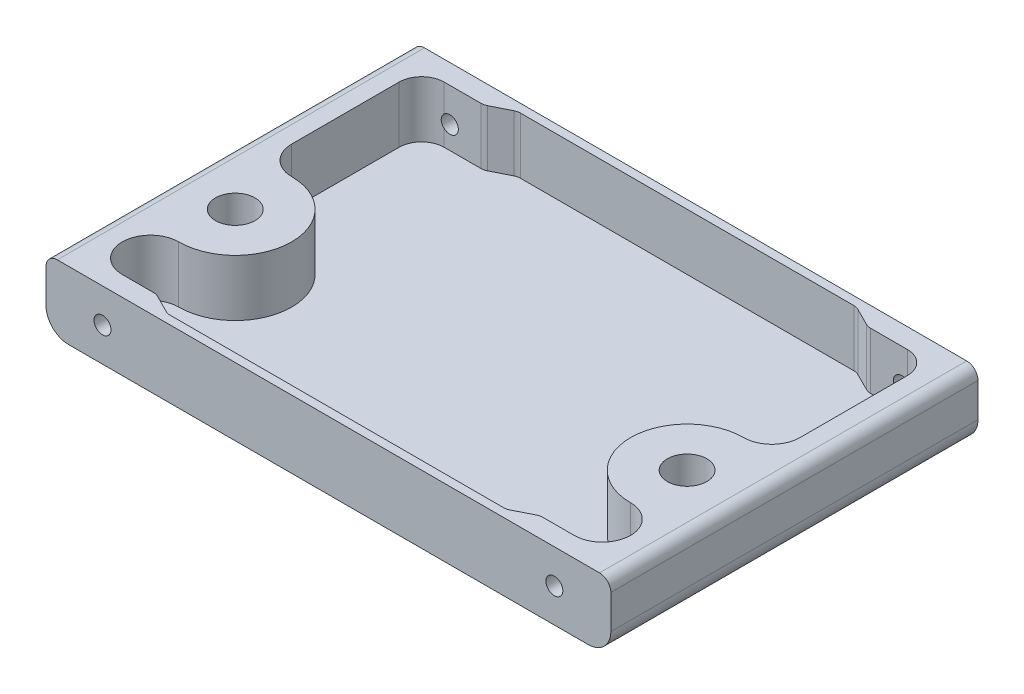
from build123d import *

# Parameters (mm, degrees)
SKETCH_1_W          = 100
SKETCH_1_H          = 65
EXTRUDE_1_DEPTH     = 12
SKETCH_2_R          = 3.5
CUT_EXTRUDE_2_DEPTH = 10
SKETCH_3_R          = 3.5
CUT_EXTRUDE_3_DEPTH = 61.466933112
SKETCH_4_R          = 3.5
CUT_EXTRUDE_4_DEPTH = 61.466933112
CUT_EXTRUDE_5_REACH = 84.879
SKETCH_5_R          = 1.5
CUT_EXTRUDE_6_REACH = 84.879
SKETCH_6_R          = 1.5
FILLET_3_R          = 2
FILLET_4_R          = 4


with BuildPart() as part:
    # 草图1 → 凸台-拉伸1 (new body)
    with BuildSketch(Plane(origin=(0, 0, 0), x_dir=(1, 0, 0), z_dir=(0, 1, 0))):
        Rectangle(SKETCH_1_W, SKETCH_1_H)
    extrude(amount=EXTRUDE_1_DEPTH)

    # 草图2 → 切除-拉伸2 (cut)
    with BuildSketch(Plane(origin=(0, 12, 0), x_dir=(1, 0, 0), z_dir=(0, 1, 0))):
        with Locations(Location((-40, -9, 0), (0, 0, 270))):
            Circle(SKETCH_2_R)
        with Locations(Location((40, -9, 0), (0, 0, 90))):
            Circle(SKETCH_2_R)
        with BuildLine():
            Line((-30.422291236, 30.788854382), (-33.577708764, 29.211145618))
            ThreePointArc((-33.577708764, 29.211145618), (-34.012630114, 29.053502021), (-34.472135955, 29))
            Line((-34.472135955, 29), (-41, 29))
            ThreePointArc((-41, 29), (-43.828427125, 27.828427125), (-45, 25))
            Line((-45, 25), (-45, 6))
            ThreePointArc((-45, 6), (-43.535533906, 2.464466094), (-40, 1))
            ThreePointArc((-40, 1), (-30, -9), (-40, -19))
            ThreePointArc((-40, -19), (-45, -24), (-40, -29))
            Line((-40, -29), (-34.439229319, -29))
            ThreePointArc((-34.439229319, -29), (-33.976113717, -29.054357705), (-33.538172016, -29.214476061))
            Line((-33.538172016, -29.214476061), (-30.425003094, -30.785523939))
            ThreePointArc((-30.425003094, -30.785523939), (-29.987061393, -30.945642295), (-29.52394579, -31))
            Line((-29.52394579, -31), (29.52394579, -31))
            ThreePointArc((29.52394579, -31), (29.987061393, -30.945642295), (30.425003094, -30.785523939))
            Line((30.425003094, -30.785523939), (33.538172016, -29.214476061))
            ThreePointArc((33.538172016, -29.214476061), (33.976113717, -29.054357705), (34.439229319, -29))
            Line((34.439229319, -29), (40, -29))
            ThreePointArc((40, -29), (45, -24), (40, -19))
            ThreePointArc((40, -19), (30, -9), (40, 1))
            ThreePointArc((40, 1), (43.535533906, 2.464466094), (45, 6))
            Line((45, 6), (45, 25))
            ThreePointArc((45, 25), (43.828427125, 27.828427125), (41, 29))
            Line((41, 29), (34.472135955, 29))
            ThreePointArc((34.472135955, 29), (34.012630114, 29.053502021), (33.577708764, 29.211145618))
            Line((33.577708764, 29.211145618), (30.422291236, 30.788854382))
            ThreePointArc((30.422291236, 30.788854382), (29.987369886, 30.946497979), (29.527864045, 31))
            Line((29.527864045, 31), (-29.527864045, 31))
            ThreePointArc((-29.527864045, 31), (-29.987369886, 30.946497979), (-30.422291236, 30.788854382))
        make_face()
    extrude(amount=-CUT_EXTRUDE_2_DEPTH, mode=Mode.SUBTRACT)

    # 草图3 → 切除-拉伸3 (cut, through all)
    with BuildSketch(Plane(origin=(0, 2, 0), x_dir=(1, 0, 0), z_dir=(0, 1, 0))):
        with Locations(Location((-40, -9, 0), (0, 0, 270))):
            Circle(SKETCH_3_R)
    extrude(amount=-CUT_EXTRUDE_3_DEPTH, mode=Mode.SUBTRACT)

    # 草图4 → 切除-拉伸4 (cut, through all)
    with BuildSketch(Plane(origin=(0, 2, 0), x_dir=(1, 0, 0), z_dir=(0, 1, 0))):
        with Locations(Location((40, -9, 0), (0, 0, 270))):
            Circle(SKETCH_4_R)
    extrude(amount=-CUT_EXTRUDE_4_DEPTH, mode=Mode.SUBTRACT)

    # 草图5 → 切除-拉伸5 (cut, up to next)
    with BuildSketch(Plane.XY.offset(32.5), mode=Mode.PRIVATE) as cut_extrude_5_sk1:
        with Locations((-40, 6)):
            Circle(SKETCH_5_R)
    cut_extrude_5_tool1 = extrude(cut_extrude_5_sk1.sketch, amount=-CUT_EXTRUDE_5_REACH, mode=Mode.PRIVATE) & part.part
    # 草图5 → 切除-拉伸5 (cut, up to next)
    with BuildSketch(Plane.XY.offset(32.5), mode=Mode.PRIVATE) as cut_extrude_5_sk2:
        with Locations((40, 6)):
            Circle(SKETCH_5_R)
    cut_extrude_5_tool2 = extrude(cut_extrude_5_sk2.sketch, amount=-CUT_EXTRUDE_5_REACH, mode=Mode.PRIVATE) & part.part
    add(cut_extrude_5_tool1.solids().sort_by_distance((-40, 6, 32.5))[0], mode=Mode.SUBTRACT)
    add(cut_extrude_5_tool2.solids().sort_by_distance((40, 6, 32.5))[0], mode=Mode.SUBTRACT)

    # 草图6 → 切除-拉伸6 (cut, up to next)
    with BuildSketch(Plane(origin=(0, 0, -32.5), x_dir=(-1, 0, 0), z_dir=(0, 0, -1)), mode=Mode.PRIVATE) as cut_extrude_6_sk1:
        with Locations(Location((-40, 6, 0), (0, 0, 180))):
            Circle(SKETCH_6_R)
    cut_extrude_6_tool1 = extrude(cut_extrude_6_sk1.sketch, amount=-CUT_EXTRUDE_6_REACH, mode=Mode.PRIVATE) & part.part
    # 草图6 → 切除-拉伸6 (cut, up to next)
    with BuildSketch(Plane(origin=(0, 0, -32.5), x_dir=(-1, 0, 0), z_dir=(0, 0, -1)), mode=Mode.PRIVATE) as cut_extrude_6_sk2:
        with Locations(Location((40, 6, 0), (0, 0, 180))):
            Circle(SKETCH_6_R)
    cut_extrude_6_tool2 = extrude(cut_extrude_6_sk2.sketch, amount=-CUT_EXTRUDE_6_REACH, mode=Mode.PRIVATE) & part.part
    add(cut_extrude_6_tool1.solids().sort_by_distance((40, 6, -32.5))[0], mode=Mode.SUBTRACT)
    add(cut_extrude_6_tool2.solids().sort_by_distance((-40, 6, -32.5))[0], mode=Mode.SUBTRACT)

    # 圆角3
    fillet_3_edges = [part.edges().sort_by_distance(p)[0] for p in [
        (-50, 12, 0),
        (50, 12, 0),
    ]]
    fillet(fillet_3_edges, radius=FILLET_3_R)

    # 圆角4
    fillet_4_edges = [part.edges().sort_by_distance(p)[0] for p in [
        (-50, 0, 0),
        (50, 0, 0),
    ]]
    fillet(fillet_4_edges, radius=FILLET_4_R)


solid = part.part
